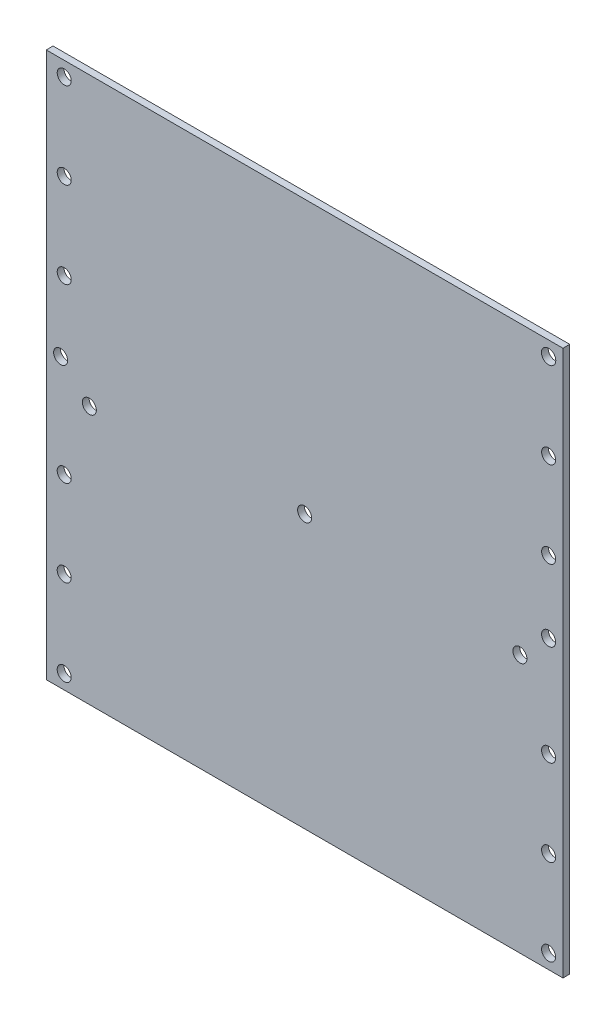
from build123d import *

# Parameters (mm, degrees)
SKETCH1_W          = 114.3
SKETCH1_H          = 120.65
EXTRUDE1_DEPTH     = 1.5
SKETCH2_R          = 1.55
SKETCH2_R_2        = 1.5875
CUT_EXTRUDE1_DEPTH = 84.111239463


with BuildPart() as part:
    # Sketch1 → Extrude1 (new body)
    with BuildSketch(Plane.XY):
        Rectangle(SKETCH1_W, SKETCH1_H)
    extrude(amount=EXTRUDE1_DEPTH)

    # Sketch2 → Cut-Extrude1 (cut, through all)
    with BuildSketch(Plane.XY.offset(1.5)):
        with Locations((-53.975, 3.175)):
            Circle(SKETCH2_R)
        with Locations((-47.625, -3.175)):
            Circle(SKETCH2_R)
        with Locations((53.975, 3.175)):
            Circle(SKETCH2_R)
        with Locations((47.625, -3.175)):
            Circle(SKETCH2_R)
        Circle(SKETCH2_R)
        with Locations((-53.18125, 57.15)):
            Circle(SKETCH2_R)
        with Locations((-53.18125, -19.05)):
            Circle(SKETCH2_R)
        with Locations((-53.18125, 38.1)):
            Circle(SKETCH2_R)
        with Locations((-53.18125, 19.05)):
            Circle(SKETCH2_R)
        with Locations((-53.18125, -38.1)):
            Circle(SKETCH2_R)
        with Locations((-53.18125, -57.15)):
            Circle(SKETCH2_R)
        with Locations((53.975, 57.15)):
            Circle(SKETCH2_R_2)
        with Locations((53.975, 38.1)):
            Circle(SKETCH2_R)
        with Locations((53.975, 19.05)):
            Circle(SKETCH2_R)
        with Locations((53.975, -19.05)):
            Circle(SKETCH2_R)
        with Locations((53.975, -38.1)):
            Circle(SKETCH2_R)
        with Locations((53.975, -57.15)):
            Circle(SKETCH2_R)
    extrude(amount=-CUT_EXTRUDE1_DEPTH, mode=Mode.SUBTRACT)


solid = part.part
